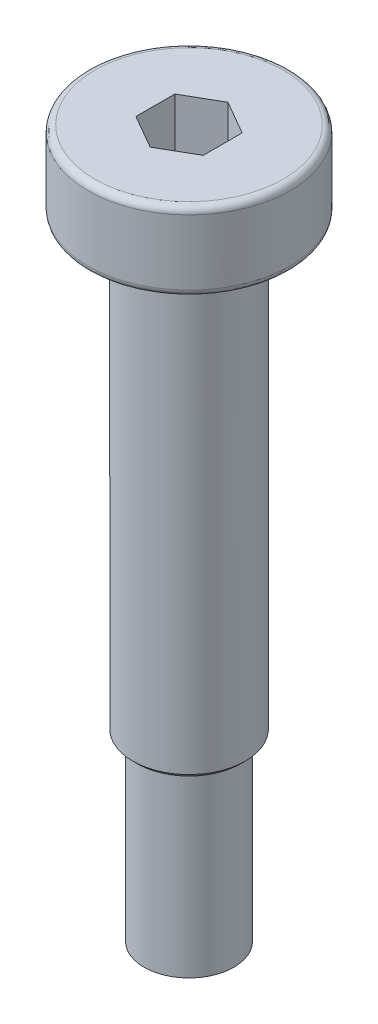
from build123d import *

# Parameters (mm, degrees)
FILLET_1_R          = 0.3
CUT_EXTRUDE_1_DEPTH = 2.4
CHAMFER_1_SIZE      = 0.2


with BuildPart() as part:
    # 草图1 → 旋转1 (revolve)
    with BuildSketch(Plane.XY, mode=Mode.PRIVATE) as revolve_1_sk:
        Polygon((0, 9.61644491), (-4.5, 9.61644491), (-4.5, 6.11644491), (-2.5, 6.11644491), (-2.5, -13.88355509), (-2, -13.88355509), (-2, -21.88355509), (0, -21.88355509), align=None)
    revolve(revolve_1_sk.sketch.rotate(Axis((0, 13.292915498, 0), (0, -1, 0)), 270), axis=Axis((0, 13.292915498, 0), (0, -1, 0)))

    # 圆角1
    fillet_1_edges = [part.edges().sort_by_distance(p)[0] for p in [
        (0, 6.11644491, -4.5),
        (0, 9.61644491, -4.5),
    ]]
    fillet(fillet_1_edges, radius=FILLET_1_R)

    # 草图2 → 切除-拉伸1 (cut)
    with BuildSketch(Plane(origin=(0, 9.61644491, 0), x_dir=(1, 0, 0), z_dir=(0, 1, 0))):
        Polygon((1.5, 0.866025404), (0, 1.732050808), (-1.5, 0.866025404), (-1.5, -0.866025404), (0, -1.732050808), (1.5, -0.866025404), align=None)
    extrude(amount=-CUT_EXTRUDE_1_DEPTH, mode=Mode.SUBTRACT)

    # 倒角1
    chamfer_1_edges = [part.edges().sort_by_distance(p)[0] for p in [
        (0, -13.88355509, -2.5),
    ]]
    chamfer(chamfer_1_edges, length=CHAMFER_1_SIZE)


solid = part.part
